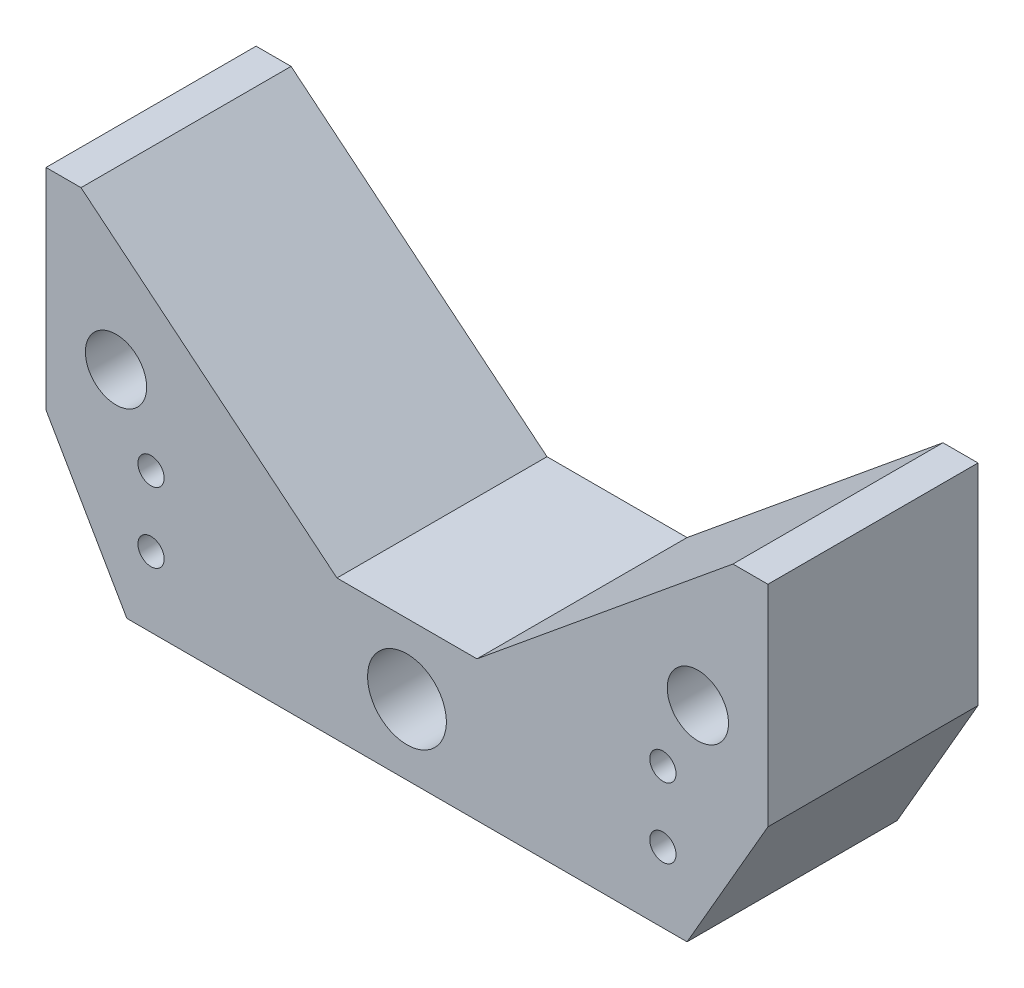
from build123d import *

# Parameters (mm, degrees)
SKETCH1_R           = 11.1125
SKETCH1_R_2         = 4.7625
SKETCH1_R_3         = 14.2875
BOSS_EXTRUDE1_DEPTH = 76.2


with BuildPart() as part:
    # Sketch1 → Boss-Extrude1 (new body)
    with BuildSketch(Plane.XY):
        Polygon((-101.6, 0), (101.6, 0), (130.929393675, 50.8), (130.929393675, 127), (118.229393675, 127), (25.4, 50.8), (-25.4, 50.8), (-118.229393675, 127), (-130.929393675, 127), (-130.929393675, 50.8), align=None)
        with Locations(Location((105.529393675, 76.2, 0), (0, 0, 180))):
            Circle(SKETCH1_R, mode=Mode.SUBTRACT)
        with Locations(Location((92.829393675, 50.8, 0), (0, 0, 180))):
            Circle(SKETCH1_R_2, mode=Mode.SUBTRACT)
        with Locations(Location((92.829393675, 25.4, 0), (0, 0, 180))):
            Circle(SKETCH1_R_2, mode=Mode.SUBTRACT)
        with Locations(Location((0, 25.4, 0), (0, 0, 180))):
            Circle(SKETCH1_R_3, mode=Mode.SUBTRACT)
        with Locations(Location((-92.829393675, 25.4, 0), (0, 0, 180))):
            Circle(SKETCH1_R_2, mode=Mode.SUBTRACT)
        with Locations(Location((-92.829393675, 50.8, 0), (0, 0, 180))):
            Circle(SKETCH1_R_2, mode=Mode.SUBTRACT)
        with Locations(Location((-105.529393675, 76.2, 0), (0, 0, 180))):
            Circle(SKETCH1_R, mode=Mode.SUBTRACT)
    extrude(amount=BOSS_EXTRUDE1_DEPTH)


solid = part.part
